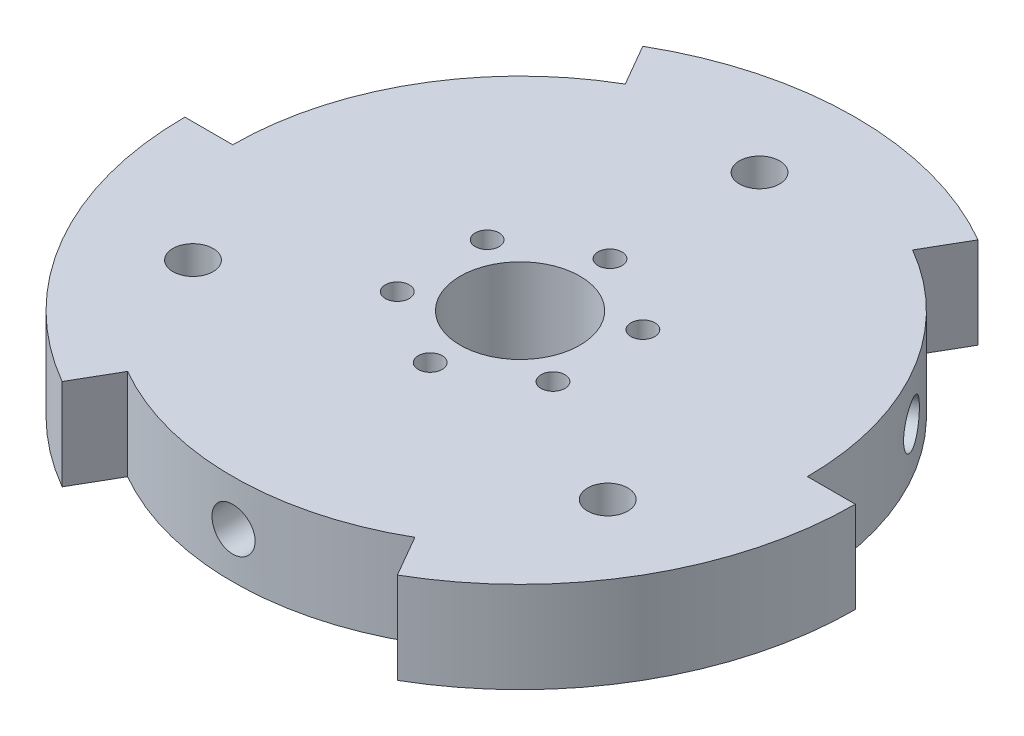
from build123d import *

# Parameters (mm, degrees)
BASEPLATE_SKETCH_R   = 2.1
BASEPLATE_SKETCH_R_2 = 6.25
BOSS_EXTRUDE1_DEPTH  = 9.525
SKETCH2_R            = 2.25
CUT_EXTRUDE1_DEPTH   = 25
CIRPATTERN1_COUNT    = 3
SKETCH3_R            = 1.25
CUT_EXTRUDE2_DEPTH   = 9.525


with BuildPart() as part:
    # Baseplate Sketch → Boss-Extrude1 (new body)
    with BuildSketch(Plane(origin=(0, 0, 0), x_dir=(1, 0, 0), z_dir=(0, 1, 0))):
        with BuildLine():
            ThreePointArc((17.5, 30.310889132), (0, 35), (-17.5, 30.310889132))
            Line((-17.5, 30.310889132), (-15, 25.980762114))
            ThreePointArc((-15, 25.980762114), (-25.980762114, 15), (-30, 0))
            Line((-30, 0), (-35, 0))
            ThreePointArc((-35, 0), (-30.310889132, -17.5), (-17.5, -30.310889132))
            Line((-17.5, -30.310889132), (-15, -25.980762114))
            ThreePointArc((-15, -25.980762114), (0, -30), (15, -25.980762114))
            Line((15, -25.980762114), (17.5, -30.310889132))
            ThreePointArc((17.5, -30.310889132), (30.310889132, -17.5), (35, 0))
            Line((35, 0), (30, 0))
            ThreePointArc((30, 0), (25.980762114, 15), (15, 25.980762114))
            Line((15, 25.980762114), (17.5, 30.310889132))
        make_face()
        with Locations(Location((0, 25, 0), (0, 0, 90))):
            Circle(BASEPLATE_SKETCH_R, mode=Mode.SUBTRACT)
        with Locations(Location((-21.650635095, -12.5, 0), (0, 0, 90))):
            Circle(BASEPLATE_SKETCH_R, mode=Mode.SUBTRACT)
        with Locations(Location((0, 0, 0), (0, 0, 90))):
            Circle(BASEPLATE_SKETCH_R_2, mode=Mode.SUBTRACT)
        with Locations(Location((21.650635095, -12.5, 0), (0, 0, 90))):
            Circle(BASEPLATE_SKETCH_R, mode=Mode.SUBTRACT)
    extrude(amount=BOSS_EXTRUDE1_DEPTH)

    # Sketch2 → Cut-Extrude1 (cut)
    with BuildSketch(Plane.XY.offset(40)):
        with Locations((0, 4.7625)):
            Circle(SKETCH2_R)
    cut_extrude1 = extrude(amount=-CUT_EXTRUDE1_DEPTH, mode=Mode.SUBTRACT)

    # CirPattern1: Cut-Extrude1 ×3 about axis
    cirpattern1_axis = Axis((0, 0, 0), (0, 1, 0))
    for i in range(1, CIRPATTERN1_COUNT):
        add(cut_extrude1.rotate(cirpattern1_axis, i * 360 / CIRPATTERN1_COUNT), mode=Mode.SUBTRACT)

    # Sketch3 → Cut-Extrude2 (cut)
    with BuildSketch(Plane(origin=(0, 9.525, 0), x_dir=(1, 0, 0), z_dir=(0, 1, 0))):
        with Locations(Location((-8.127648415, -4.6925, 0), (0, 0, 270))):
            Circle(SKETCH3_R)
        with Locations(Location((0, -9.385, 0), (0, 0, 270))):
            Circle(SKETCH3_R)
        with Locations(Location((-8.127648415, 4.6925, 0), (0, 0, 270))):
            Circle(SKETCH3_R)
        with Locations(Location((0, 9.385, 0), (0, 0, 270))):
            Circle(SKETCH3_R)
        with Locations(Location((8.127648415, 4.6925, 0), (0, 0, 270))):
            Circle(SKETCH3_R)
        with Locations(Location((8.127648415, -4.6925, 0), (0, 0, 270))):
            Circle(SKETCH3_R)
    extrude(amount=-CUT_EXTRUDE2_DEPTH, mode=Mode.SUBTRACT)


solid = part.part
